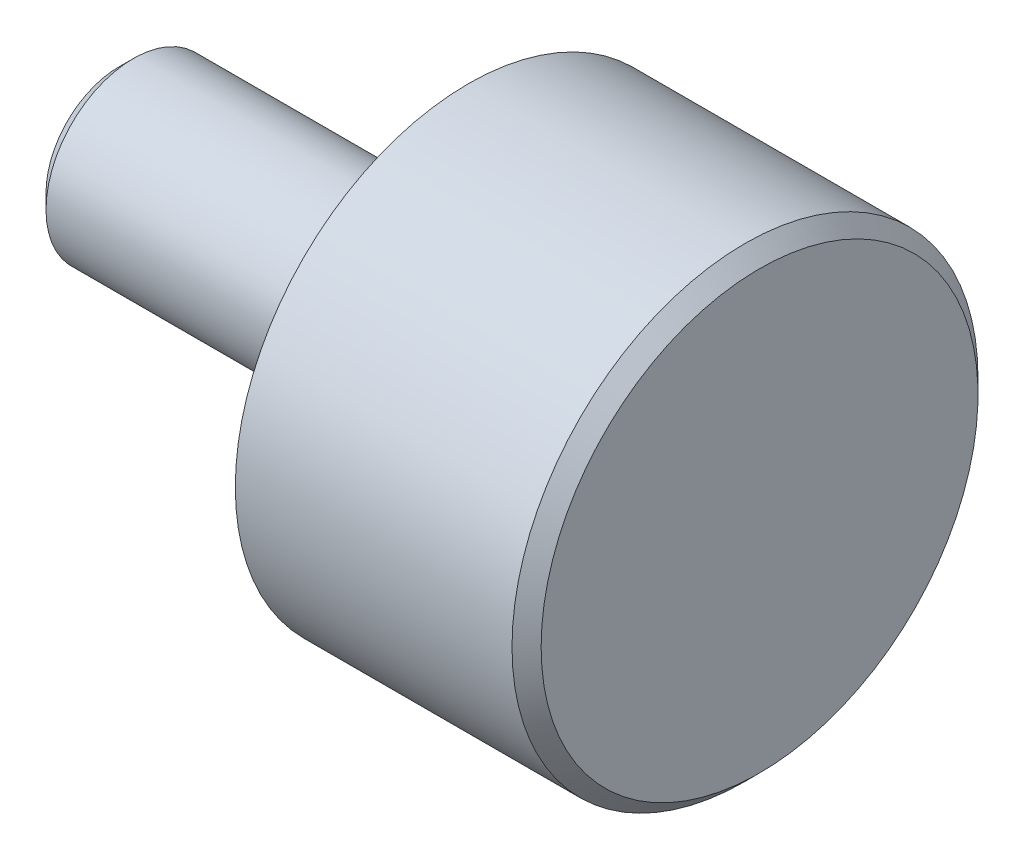
from build123d import *


with BuildPart() as part:
    # Sketch_Tip_Profile → Tip_Revolve_D16x10_Stud_M6x12 (revolve)
    with BuildSketch(Plane.XY):
        Polygon((-12, 0), (-12, 2.5), (-11.5, 3), (0, 3), (0, 8), (9.5, 8), (10, 7.5), (10, 0), align=None)
    revolve(axis=Axis((-15, 0, 0), (1, 0, 0)))


solid = part.part
